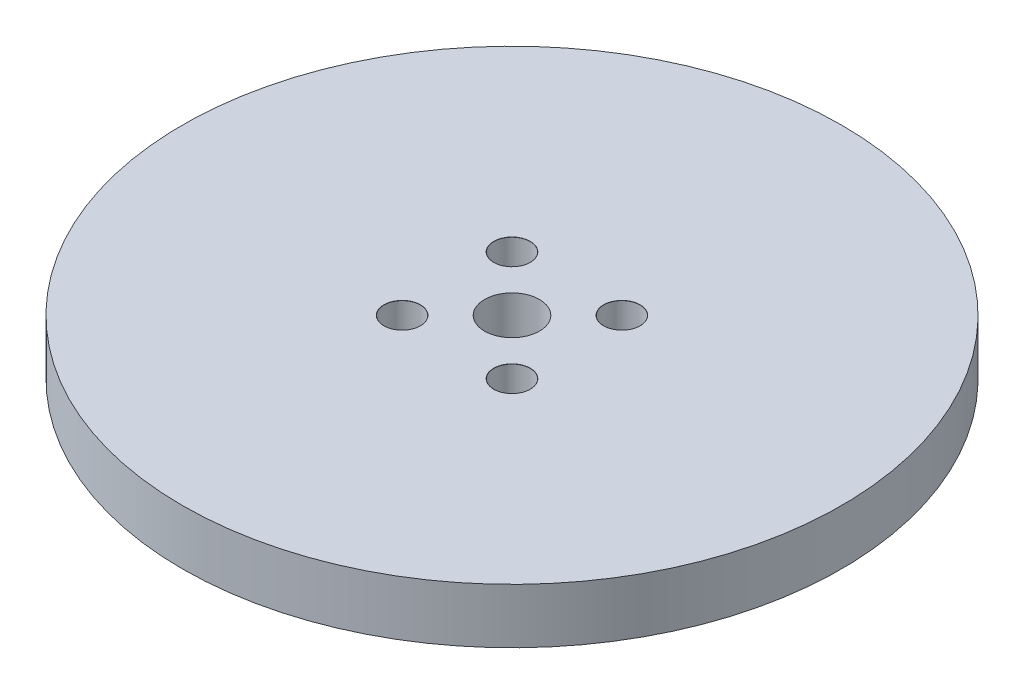
from build123d import *

# Parameters (mm, degrees)
SKETCH1_R                      = 60
SKETCH1_R_2                    = 5
BOSS_EXTRUDE1_DEPTH            = 10
M6_CLEARANCE_HOLE1_D           = 6.6
M6_CLEARANCE_HOLE1_CSINK_D     = 6.65
M6_CLEARANCE_HOLE1_CSINK_ANGLE = 100


with BuildPart() as part:
    # Sketch1 → Boss-Extrude1 (new body)
    with BuildSketch(Plane(origin=(0, 0, 0), x_dir=(1, 0, 0), z_dir=(0, 1, 0))):
        with Locations(Location((0, 0, 0), (0, 0, 270))):
            Circle(SKETCH1_R)
        with Locations(Location((0, 0, 0), (0, 0, 270))):
            Circle(SKETCH1_R_2, mode=Mode.SUBTRACT)
    extrude(amount=BOSS_EXTRUDE1_DEPTH)

    # M6 Clearance Hole1 (through all)
    with Locations(Plane(origin=(0, 10, 0), x_dir=(1, 0, 0), z_dir=(0, 1, 0))):
        with Locations((-10, 10), (10, 10), (-10, -10), (10, -10)):
            CounterSinkHole(M6_CLEARANCE_HOLE1_D / 2, M6_CLEARANCE_HOLE1_CSINK_D / 2, counter_sink_angle=M6_CLEARANCE_HOLE1_CSINK_ANGLE)


solid = part.part
